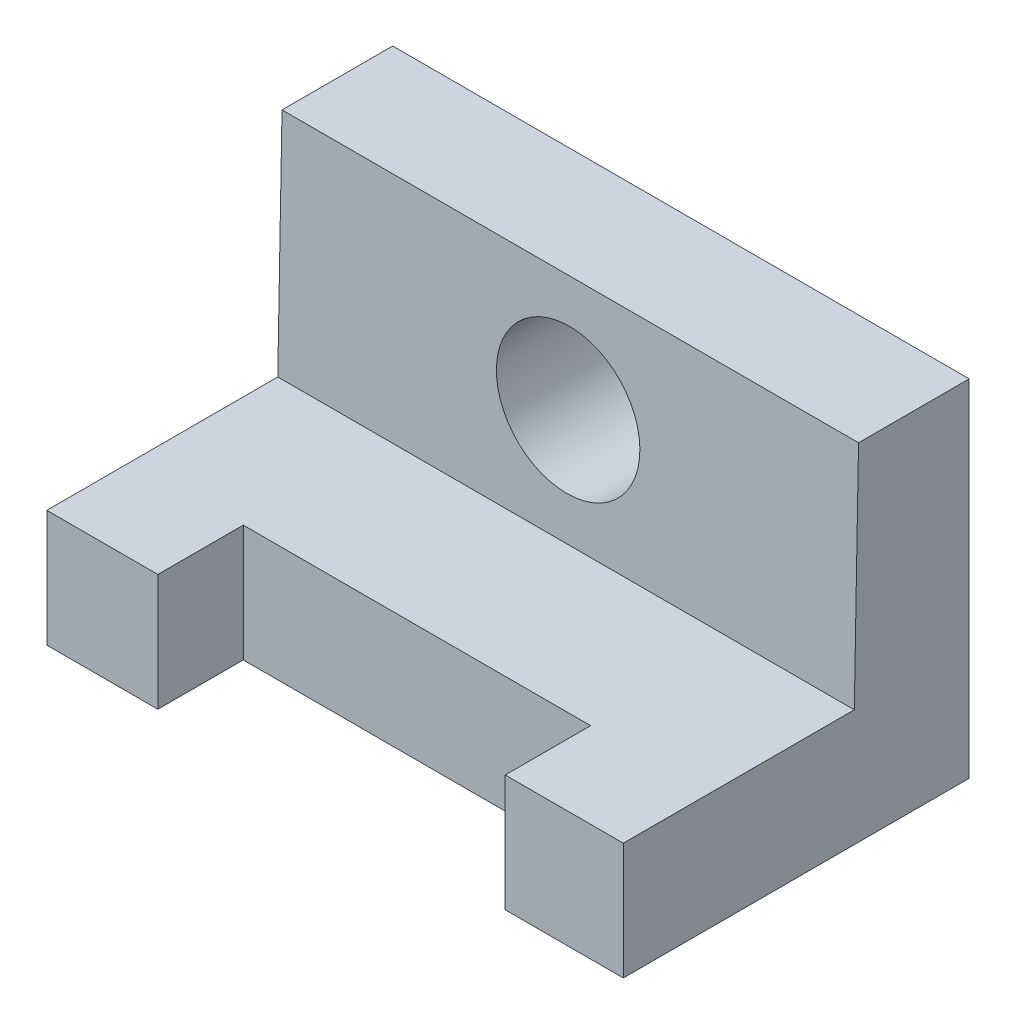
from build123d import *

# Parameters (mm, degrees)
BOSS_EXTRUDE1_DEPTH = 100
SKETCH5_R           = 12.44300021
SKETCH5_W           = 62.427684028
SKETCH5_H           = 20.04871256
CUT_EXTRUDE1_DEPTH  = 100
SKETCH6_W           = 60.250527476
SKETCH6_H           = 14.81598125
CUT_EXTRUDE2_DEPTH  = 100


with BuildPart() as part:
    # Sketch2 → Boss-Extrude1 (new body)
    with BuildSketch(Plane(origin=(0, 0, 0), x_dir=(0, 0, -1), z_dir=(1, 0, 0))):
        Polygon((0, 0), (0, -60), (-60, -60), (-60, -39.746873043), (-19.935380451, -39.746873043), (-19.198069057, 0), align=None)
    extrude(amount=BOSS_EXTRUDE1_DEPTH)

    # Sketch5 → Cut-Extrude1 (cut)
    with BuildSketch(Plane(origin=(0, 0.356005009, 19.191465102), x_dir=(1, 0, 0), z_dir=(0, 0.018546982770064533, 0.99982798992133))):
        with Locations(Location((50, -20.232921797, 0), (0, 0, 270))):
            Circle(SKETCH5_R)
        with Locations((27.151963887, -76.870783424)):
            Rectangle(SKETCH5_W, SKETCH5_H)
    extrude(amount=-CUT_EXTRUDE1_DEPTH, mode=Mode.SUBTRACT)

    # Sketch6 → Cut-Extrude2 (cut)
    with BuildSketch(Plane(origin=(0, -39.746873043, 0), x_dir=(1, 0, 0), z_dir=(0, 1, 0))):
        with Locations((49.391031419, -52.592009375)):
            Rectangle(SKETCH6_W, SKETCH6_H)
    extrude(amount=-CUT_EXTRUDE2_DEPTH, mode=Mode.SUBTRACT)


solid = part.part
